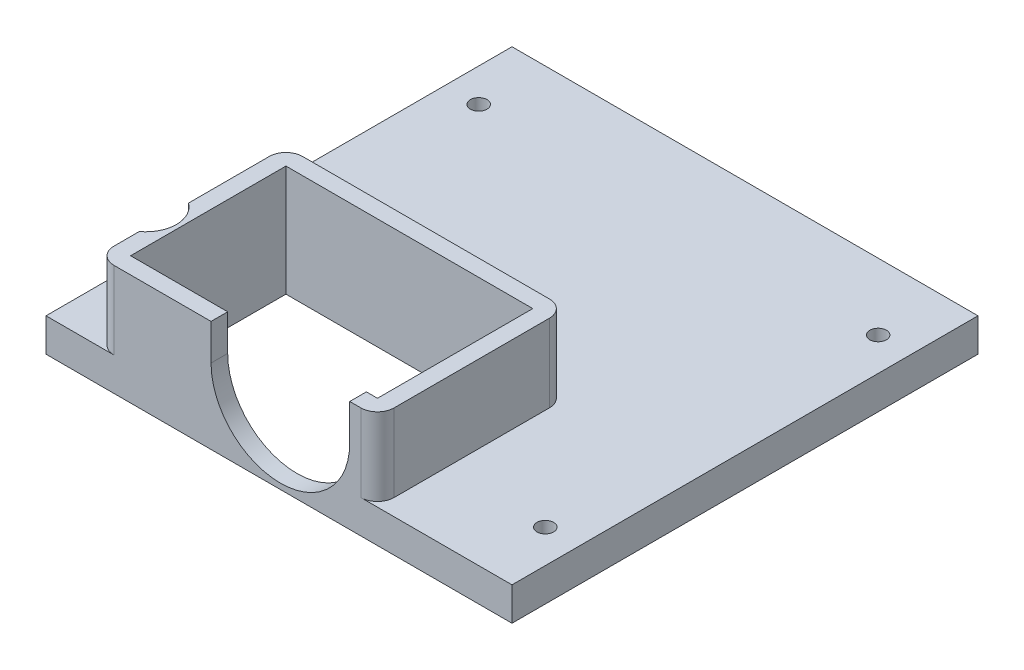
from build123d import *

# Parameters (mm, degrees)
SKETCH1_W                                = 84
SKETCH1_H                                = 84
BOSS_EXTRUDE1_DEPTH                      = 6
SKETCH2_R                                = 1.5
CUT_EXTRUDE1_DEPTH                       = 119.94536561
SKETCH5_W                                = 50.5
SKETCH5_H                                = 34
BOSS_EXTRUDE2_DEPTH                      = 22
SKETCH6_W                                = 44.5
SKETCH6_H                                = 28
CUT_EXTRUDE5_DEPTH                       = 25
FILLET1_R                                = 3
SKETCH8_R                                = 12.5
CUT_EXTRUDE6_DEPTH                       = 10
CUT_EXTRUDE7_DEPTH                       = 123.049170419
CUT_EXTRUDE7_DEPTH_BACK                  = 123.049170419
SKETCH9_W                                = 84
SKETCH9_H                                = 8
CUT_EXTRUDE8_DEPTH                       = 3
MIRROR1_AT_THE_SECOND_PLANE_COPY_1_DEPTH = 3
SKETCH13_R                               = 5.5
CUT_EXTRUDE9_DEPTH                       = 14
CUT_EXTRUDE10_DEPTH                      = 10
CUT_EXTRUDE11_DEPTH                      = 10
BOSS_EXTRUDE3_DEPTH                      = 3
CUT_EXTRUDE14_DEPTH                      = 4
SKETCH20_W                               = 13.564659966
SKETCH20_H                               = 7
CUT_EXTRUDE15_DEPTH                      = 4


with BuildPart() as part:
    # Sketch1 → Boss-Extrude1 (new body)
    with BuildSketch(Plane(origin=(0, 0, 0), x_dir=(1, 0, 0), z_dir=(0, 1, 0))):
        with Locations((42, 42)):
            Rectangle(SKETCH1_W, SKETCH1_H)
    extrude(amount=BOSS_EXTRUDE1_DEPTH)

    # Sketch2 → Cut-Extrude1 (cut, through all)
    with BuildSketch(Plane(origin=(0, 6, 0), x_dir=(1, 0, 0), z_dir=(0, 1, 0))):
        with Locations(Location((6, 72, 0), (0, 0, 270))):
            Circle(SKETCH2_R)
        with Locations(Location((6, 12, 0), (0, 0, 270))):
            Circle(SKETCH2_R)
        with Locations(Location((78, 12, 0), (0, 0, 270))):
            Circle(SKETCH2_R)
        with Locations(Location((78, 72, 0), (0, 0, 270))):
            Circle(SKETCH2_R)
    extrude(amount=-CUT_EXTRUDE1_DEPTH, mode=Mode.SUBTRACT)

    # Sketch5 → Boss-Extrude2 (add)
    with BuildSketch(Plane(origin=(0, 6, 0), x_dir=(1, 0, 0), z_dir=(0, 1, 0))):
        with Locations((34.5, 17)):
            Rectangle(SKETCH5_W, SKETCH5_H)
    extrude(amount=BOSS_EXTRUDE2_DEPTH)

    # Sketch6 → Cut-Extrude5 (cut)
    with BuildSketch(Plane(origin=(0, 28, 0), x_dir=(1, 0, 0), z_dir=(0, 1, 0))):
        with Locations((34.5, 17)):
            Rectangle(SKETCH6_W, SKETCH6_H)
    extrude(amount=-CUT_EXTRUDE5_DEPTH, mode=Mode.SUBTRACT)

    # Fillet1
    fillet1_edges = [part.edges().sort_by_distance(p)[0] for p in [
        (59.75, 17, -34),
        (9.25, 17, -34),
        (9.25, 17, 0),
        (59.75, 17, 0),
    ]]
    fillet(fillet1_edges, radius=FILLET1_R)

    # Sketch8 → Cut-Extrude6 (cut)
    with BuildSketch(Plane.XY):
        with Locations((42.25, 13.5)):
            Circle(SKETCH8_R)
    extrude(amount=-CUT_EXTRUDE6_DEPTH, mode=Mode.SUBTRACT)

    # Sketch9 → Cut-Extrude7 (cut, two sides: drawn at the far end of the back side and taken through both)
    with BuildSketch(Plane.XY.offset(-CUT_EXTRUDE7_DEPTH_BACK)):
        with Locations((42, 24)):
            Rectangle(SKETCH9_W, SKETCH9_H)
    extrude(amount=CUT_EXTRUDE7_DEPTH + CUT_EXTRUDE7_DEPTH_BACK, mode=Mode.SUBTRACT)

    # Sketch11 → Cut-Extrude8 (cut)
    with BuildSketch(Plane.XZ):
        Polygon((3, -9), (13, -9), (13, -15), (8, -21), (3, -21), align=None)
    cut_extrude8 = extrude(amount=-CUT_EXTRUDE8_DEPTH, mode=Mode.SUBTRACT)

    # Mirror1: Cut-Extrude8 across plane
    add(cut_extrude8.mirror(Plane.XY.offset(-42)), mode=Mode.SUBTRACT)

    # Mirror1 at the second plane: Cut-Extrude8 across plane
    add(cut_extrude8.mirror(Plane.ZY.offset(-42)), mode=Mode.SUBTRACT)

    # Mirror1 at the second plane copy 1 sketc → Mirror1 at the second plane copy 1 (cut)
    with BuildSketch(Plane(origin=(84, 0, -84), x_dir=(-1, 0, 0), z_dir=(0, -1, 0))):
        Polygon((3, -9), (13, -9), (13, -15), (8, -21), (3, -21), align=None)
    extrude(amount=-MIRROR1_AT_THE_SECOND_PLANE_COPY_1_DEPTH, mode=Mode.SUBTRACT)

    # Sketch13 → Cut-Extrude9 (cut)
    with BuildSketch(Plane(origin=(0, 20, 0), x_dir=(1, 0, 0), z_dir=(0, 1, 0))):
        with Locations((6, 12)):
            Circle(SKETCH13_R)
    extrude(amount=-CUT_EXTRUDE9_DEPTH, mode=Mode.SUBTRACT)

    # Sketch14 → Cut-Extrude10 (cut)
    with BuildSketch(Plane.XY):
        Polygon((29.75, 13.5), (29.75, 20), (31.572921748, 20), align=None)
    extrude(amount=-CUT_EXTRUDE10_DEPTH, mode=Mode.SUBTRACT)

    # Sketch15 → Cut-Extrude11 (cut)
    with BuildSketch(Plane.XY):
        Polygon((54.75, 20), (54.75, 13.5), (52.927078252, 20), align=None)
    extrude(amount=-CUT_EXTRUDE11_DEPTH, mode=Mode.SUBTRACT)

    # Sketch17 → Boss-Extrude3 (add)
    with BuildSketch(Plane.XZ):
        Polygon((8.833333333, -9), (8.833333333, -20), (13, -15), (13, -9), align=None)
    extrude(amount=-BOSS_EXTRUDE3_DEPTH)

    # Sketch18 → Cut-Extrude14 (cut)
    with BuildSketch(Plane(origin=(0, 3, 0), x_dir=(1, 0, 0), z_dir=(0, 1, 0))):
        Polygon((35.467670017, 3), (35.467670017, 10), (49.032329983, 10), (49.032329983, 3), (56.75, 3), (56.75, 31), (12.25, 31), (12.25, 3), align=None)
    extrude(amount=-CUT_EXTRUDE14_DEPTH, mode=Mode.SUBTRACT)

    # Sketch20 → Cut-Extrude15 (cut)
    with BuildSketch(Plane.XZ):
        with Locations((42.25, -6.5)):
            Rectangle(SKETCH20_W, SKETCH20_H)
    extrude(amount=-CUT_EXTRUDE15_DEPTH, mode=Mode.SUBTRACT)


solid = part.part
